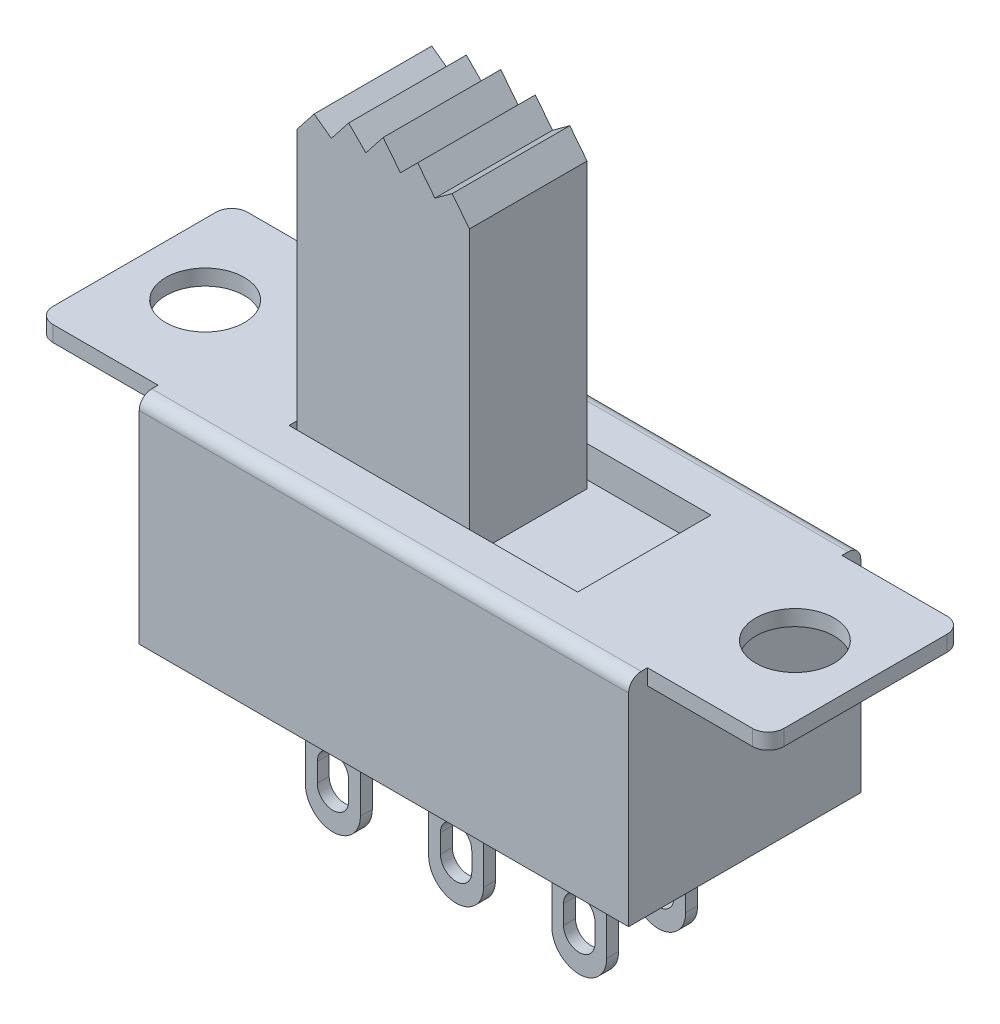
from build123d import *

# Parameters (mm, degrees)
ESQUISSE1_W           = 3.85
ESQUISSE1_H           = 6.2
ESQUISSE1_R           = 1.25
PLAQUE_DEPTH          = 0.5
CORPS_DEPTH           = 6.85
CONG_R                = 0.5
ESQUISSE2_W           = 9.2
ESQUISSE2_H           = 4.25
CAVIT_DEPTH           = 1
ESQUISSE3_W           = 5.5
ESQUISSE3_H           = 3.75
BOUTON_DEPTH          = 10.2
RELIEF_DEPTH          = 16.856958252
CONG_2_R              = 0.4
ESQUISSE6_W           = 2.15
ESQUISSE6_H           = 0.38
PIN_DEPTH             = 4.4
ARRONDI_DEPTH         = 0.38
PERCAGE_DEPTH         = 0.38
R_P_TITION_COUNT      = 3
R_P_TITION_PITCH      = 3.925
R_P_TITION_COUNT_DIR2 = 2
R_P_TITION_PITCH_DIR2 = 2.52


with BuildPart() as part:
    # Esquisse1 → Plaque (new body)
    # profile 1 of 2: a face of its own
    with BuildSketch(Plane(origin=(0, 0, 0), x_dir=(1, 0, 0), z_dir=(0, 1, 0))):
        with Locations((-9.725, 0)):
            Rectangle(ESQUISSE1_W, ESQUISSE1_H)
        with Locations(Location((-9.4, 0, 0), (0, 0, 270))):
            Circle(ESQUISSE1_R, mode=Mode.SUBTRACT)
    # profile 2 of 2: a face of its own
    with BuildSketch(Plane(origin=(0, 0, 0), x_dir=(1, 0, 0), z_dir=(0, 1, 0))):
        with Locations((9.725, 0)):
            Rectangle(ESQUISSE1_W, ESQUISSE1_H)
        with Locations(Location((9.4, 0, 0), (0, 0, 270))):
            Circle(ESQUISSE1_R, mode=Mode.SUBTRACT)
    extrude(amount=-PLAQUE_DEPTH)

    # Esquisse1<5> → Corps (add)
    with BuildSketch(Plane(origin=(0, 0, 0), x_dir=(1, 0, 0), z_dir=(0, 1, 0))):
        Polygon((7.8, 3.1), (7.8, -3.1), (7.8, -3.7), (-7.8, -3.7), (-7.8, -3.1), (-7.8, 3.1), (-7.8, 3.7), (7.8, 3.7), align=None)
    extrude(amount=-CORPS_DEPTH)

    # Congé
    cong_edges = [part.edges().sort_by_distance(p)[0] for p in [
        (-11.65, -0.25, 3.1),
        (-11.65, -0.25, -3.1),
        (11.65, -0.25, -3.1),
        (11.65, -0.25, 3.1),
    ]]
    fillet(cong_edges, radius=CONG_R)

    # Esquisse2 → Cavité (cut)
    with BuildSketch(Plane(origin=(0, 0, 0), x_dir=(1, 0, 0), z_dir=(0, 1, 0))):
        Rectangle(ESQUISSE2_W, ESQUISSE2_H)
    extrude(amount=-CAVIT_DEPTH, mode=Mode.SUBTRACT)

    # Esquisse3 → Bouton (add)
    with BuildSketch(Plane(origin=(0, -1, 0), x_dir=(1, 0, 0), z_dir=(0, 1, 0))):
        with Locations((-1.85, 0)):
            Rectangle(ESQUISSE3_W, ESQUISSE3_H)
    extrude(amount=BOUTON_DEPTH)

    # Esquisse5 → Relief (cut, through all)
    with BuildSketch(Plane.XY.offset(1.875)):
        Polygon((-4.6, 9.2), (-4.6, 8.05), (-4.05, 8.75), (-3.5, 8.35), (-2.95, 9.05), (-2.4, 8.5), (-1.85, 9.2), align=None)
        Polygon((0.9, 9.2), (-1.85, 9.2), (-1.3, 8.5), (-0.75, 9.05), (-0.2, 8.35), (0.35, 8.75), (0.9, 8.05), align=None)
    extrude(amount=-RELIEF_DEPTH, mode=Mode.SUBTRACT)

    # Congé2
    cong_2_edges = [part.edges().sort_by_distance(p)[0] for p in [
        (0, 0, -3.7),
        (0, 0, 3.7),
    ]]
    fillet(cong_2_edges, radius=CONG_2_R)

    # Esquisse6 → Pin (add)
    with BuildSketch(Plane.XZ.offset(6.85)):
        with Locations((-3.925, 1.21)):
            Rectangle(ESQUISSE6_W, ESQUISSE6_H)
    pin = extrude(amount=PIN_DEPTH)

    # Esquisse8 → Arrondi (cut)
    with BuildSketch(Plane.XY.offset(1.4)):
        with BuildLine():
            Line((-4.8, -7.45), (-5, -7.15))
            Line((-5, -7.15), (-5, -11.25))
            Line((-5, -11.25), (-3.925, -11.25))
            ThreePointArc((-3.925, -11.25), (-4.543718434, -10.993718434), (-4.8, -10.375))
            Line((-4.8, -10.375), (-4.8, -7.45))
        make_face()
        with BuildLine():
            Line((-2.85, -11.25), (-2.85, -7.15))
            Line((-2.85, -7.15), (-3.05, -7.45))
            Line((-3.05, -7.45), (-3.05, -10.375))
            ThreePointArc((-3.05, -10.375), (-3.306281566, -10.993718434), (-3.925, -11.25))
            Line((-3.925, -11.25), (-2.85, -11.25))
        make_face()
    arrondi = extrude(amount=-ARRONDI_DEPTH, mode=Mode.SUBTRACT)

    # Esquisse9 → Percage (cut)
    with BuildSketch(Plane.XY.offset(1.4)):
        with BuildLine():
            Line((-4.425, -10.15), (-4.425, -9.55))
            ThreePointArc((-4.425, -9.55), (-3.925, -9.05), (-3.425, -9.55))
            Line((-3.425, -9.55), (-3.425, -10.15))
            ThreePointArc((-3.425, -10.15), (-3.925, -10.65), (-4.425, -10.15))
        make_face()
    percage = extrude(amount=-PERCAGE_DEPTH, mode=Mode.SUBTRACT)

    # Répétition: Pin, Arrondi, Percage 3 × 2
    with Locations(*[(i * R_P_TITION_PITCH, 0, -j * R_P_TITION_PITCH_DIR2) for i in range(R_P_TITION_COUNT) for j in range(R_P_TITION_COUNT_DIR2) if (i, j) != (0, 0)]):
        add(pin)
        add(arrondi, mode=Mode.SUBTRACT)
        add(percage, mode=Mode.SUBTRACT)


solid = part.part
